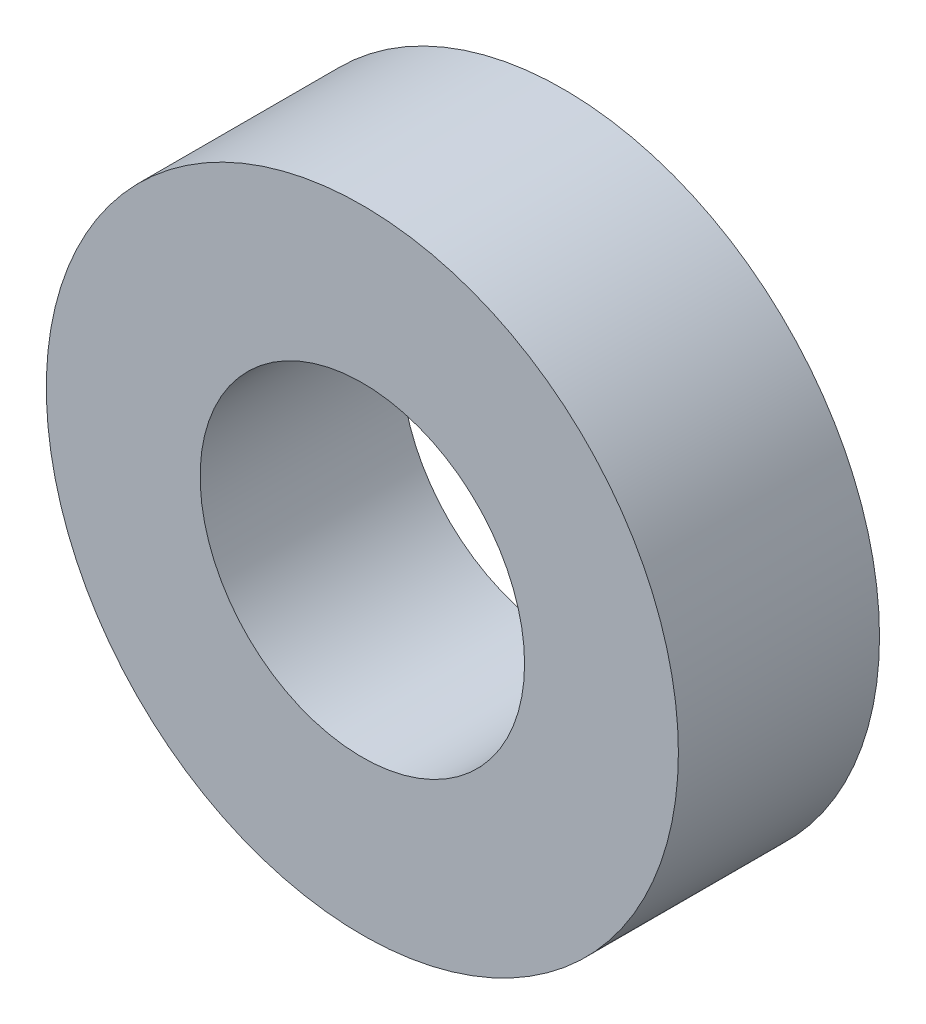
from build123d import *

# Parameters (mm, degrees)
CROQUIS1_R              = 11
CROQUIS1_R_2            = 5.646258403
SALIENTE_EXTRUIR1_DEPTH = 7


with BuildPart() as part:
    # Croquis1 → Saliente-Extruir1 (new body)
    with BuildSketch(Plane.XY):
        Circle(CROQUIS1_R)
        Circle(CROQUIS1_R_2, mode=Mode.SUBTRACT)
    extrude(amount=SALIENTE_EXTRUIR1_DEPTH)


solid = part.part
